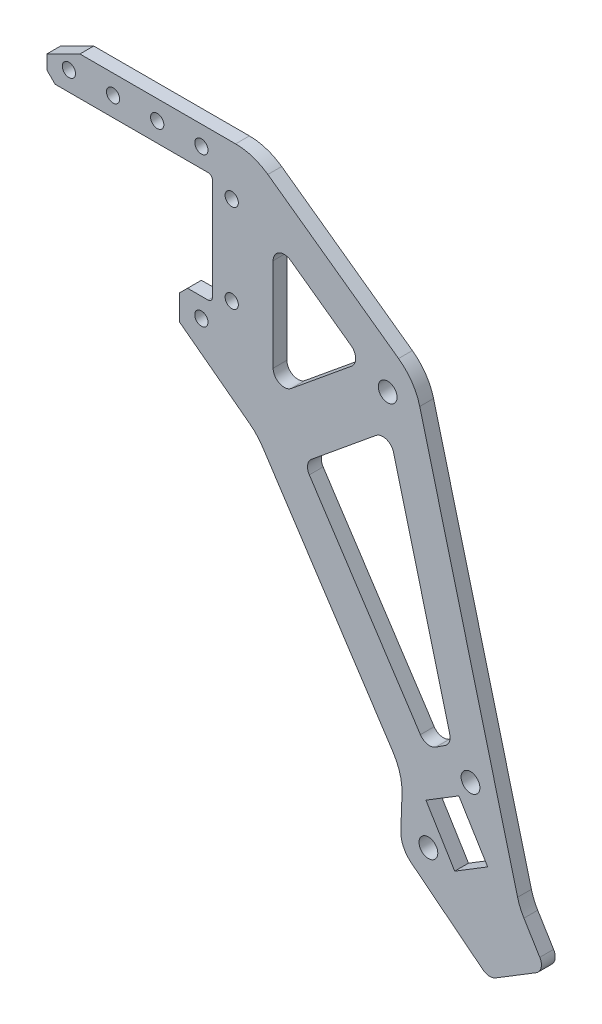
from build123d import *
from OCP.BRepFilletAPI import BRepFilletAPI_MakeFillet

# Parameters (mm, degrees)
SALIENTE_EXTRUIR1_DEPTH = 1.25
CHAFL_N1_SIZE           = 1.5
CHAFL_N2_SIZE           = 6
CHAFL_N2_SIZE2          = 3
REDONDEO1_R             = 2
REDONDEO2_R1            = 10
REDONDEO2_R2            = 5
REDONDEO3_R             = 0.8
CROQUIS6_R              = 1.2
CROQUIS6_R_2            = 1.7
CORTAR_EXTRUIR1_DEPTH   = 132.636209799


with BuildPart() as part:
    # Croquis5 → Saliente-Extruir1 (new, symmetric)
    with BuildSketch(Plane.XY):
        Polygon((-33.3960961, -67.058199354), (-49.468312924, -54.332876319), (-49.042492677, -42.832876319), (-75.361903804, -2.692016862), (-89.503725327, 7.973817187), (-89.503725327, 13.973817187), (-83.503725327, 13.973817187), (-83.503725327, 33.973817187), (-108.003725327, 33.973817187), (-113.503725327, 33.973817187), (-113.503725327, 40.973817187), (-83.503725327, 40.973817187), (-76.07625416, 40.973817187), (-46.8531225, 19.949817187), (-27.852472036, -53.120185426), (-23.157930014, -60.798809991), align=None)
        Polygon((-51.475681089, 9.911759166), (-40.150790084, -33.639898021), (-44.730652374, -36.642805286), (-66.937655512, -2.77395512), align=None, mode=Mode.SUBTRACT)
        Polygon((-72.503725327, 4.947596176), (-56.268652183, 18.267596176), (-72.503725327, 29.947596176), align=None, mode=Mode.SUBTRACT)
    extrude(amount=SALIENTE_EXTRUIR1_DEPTH, both=True)

    # Chaflán1
    chafl_n1_edges = [part.edges().sort_by_distance(p)[0] for p in [
        (-113.503725327, 33.973817187, 0),
        (-89.503725327, 13.973817187, 0),
    ]]
    chamfer(chafl_n1_edges, length=CHAFL_N1_SIZE)

    # Chaflán2
    chafl_n2_edges = [part.edges().sort_by_distance(p)[0] for p in [
        (-113.503725327, 40.973817187, 0),
    ]]
    chafl_n2_side = [part.faces().sort_by_distance(p)[0] for p in [
        (-94.789989743, 40.973817187, 0),
    ]]
    chamfer(chafl_n2_edges, length=CHAFL_N2_SIZE, length2=CHAFL_N2_SIZE2, reference=chafl_n2_side[0])

    # Redondeo1
    redondeo1_edges = [part.edges().sort_by_distance(p)[0] for p in [
        (-23.157930014, -60.798809991, 0),
        (-33.3960961, -67.058199354, 0),
        (-51.475681089, 9.911759166, 0),
        (-66.937655512, -2.77395512, 0),
        (-44.730652374, -36.642805286, 0),
        (-40.150790084, -33.639898021, 0),
        (-56.268652183, 18.267596176, 0),
        (-72.503725327, 29.947596176, 0),
        (-72.503725327, 4.947596176, 0),
    ]]
    fillet(redondeo1_edges, radius=REDONDEO1_R)

    # Redondeo2: one fillet with a radius per group of edges: ONE call of the kernel's fillet builder (fillet() takes one radius for all edges)
    redondeo2_edges_1 = [part.edges().sort_by_distance(p)[0] for p in [
        (-76.07625416, 40.973817187, 0),
        (-46.8531225, 19.949817187, 0),
        (-75.361903804, -2.692016862, 0),
        (-27.852472036, -53.120185426, 0),
        (-49.042492677, -42.832876319, 0),
    ]]
    redondeo2_edges_2 = [part.edges().sort_by_distance(p)[0] for p in [
        (-49.468312924, -54.332876319, 0),
    ]]
    redondeo2 = BRepFilletAPI_MakeFillet(part.part.solid().wrapped)
    for e in redondeo2_edges_1:
        redondeo2.Add(REDONDEO2_R1, e.wrapped)
    for e in redondeo2_edges_2:
        redondeo2.Add(REDONDEO2_R2, e.wrapped)
    add(Compound.cast(redondeo2.Shape()), mode=Mode.REPLACE)

    # Redondeo3
    redondeo3_edges = [part.edges().sort_by_distance(p)[0] for p in [
        (-83.503725327, 13.973817187, 0),
        (-83.503725327, 33.973817187, 0),
    ]]
    fillet(redondeo3_edges, radius=REDONDEO3_R)

    # Croquis6 → Cortar-Extruir1 (cut, through all)
    with BuildSketch(Plane.XY.offset(1.25)):
        with Locations((-80.003725327, 31.973817187)):
            Circle(CROQUIS6_R)
        with Locations((-80.003725327, 15.973817187)):
            Circle(CROQUIS6_R)
        with Locations((-85.503725327, 37.473817187)):
            Circle(CROQUIS6_R)
        with Locations((-93.503725327, 37.473817187)):
            Circle(CROQUIS6_R)
        with Locations((-101.503725327, 37.473817187)):
            Circle(CROQUIS6_R)
        with Locations((-109.503725327, 37.473817187)):
            Circle(CROQUIS6_R)
        with Locations((-85.503725327, 10.473817187)):
            Circle(CROQUIS6_R)
        with Locations((-51.75750024, 15.82464715)):
            Circle(CROQUIS6_R_2)
        with Locations((-36.753725327, -37.919792915)):
            Circle(CROQUIS6_R_2)
        with Locations((-44.377518673, -51.986696449)):
            Circle(CROQUIS6_R_2)
        Polygon((-39.612609009, -53.277564811), (-33.640345459, -49.626254349), (-38.856503262, -41.094449277), (-44.828766812, -44.745759739), align=None)
    extrude(amount=-CORTAR_EXTRUIR1_DEPTH, mode=Mode.SUBTRACT)


solid = part.part
